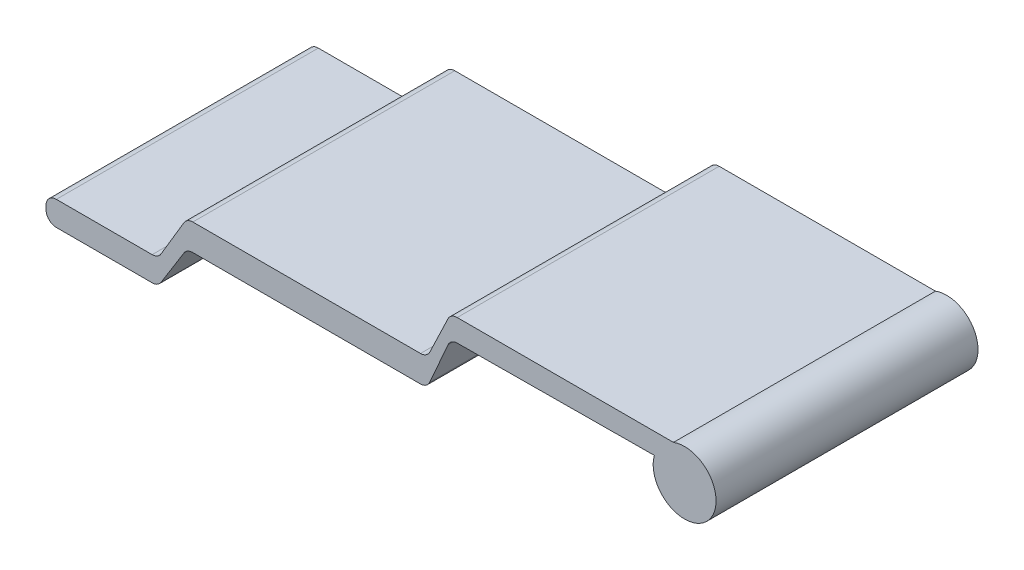
from build123d import *

# Parameters (mm, degrees)
SKETCH_3_R      = 4.562700836
EXTRUDE_3_DEPTH = 38


with BuildPart() as part:
    # 草图3 → 凸台-拉伸3 (new body)
    with BuildSketch(Plane.XY):
        with Locations((92.630544214, 13.494641075)):
            Circle(SKETCH_3_R)
        with BuildLine():
            ThreePointArc((91.130544214, 14.762196375), (92.191204386, 15.201536203), (92.630544214, 16.262196375))
            ThreePointArc((92.630544214, 16.262196375), (92.191204386, 17.322856547), (91.130544214, 17.762196375))
            Line((91.130544214, 17.762196375), (59.64523969, 17.762196375))
            ThreePointArc((59.64523969, 17.762196375), (58.845330036, 17.531111086), (58.291883519, 16.909055768))
            Line((58.291883519, 16.909055768), (55.677790218, 11.439862088))
            ThreePointArc((55.677790218, 11.439862088), (55.124343701, 10.817806769), (54.324434046, 10.586721481))
            Line((54.324434046, 10.586721481), (21.297445186, 10.586721481))
            ThreePointArc((21.297445186, 10.586721481), (20.556052671, 10.390691242), (20.008440624, 9.853837664))
            Line((20.008440624, 9.853837664), (16.684963935, 4.269316435))
            ThreePointArc((16.684963935, 4.269316435), (16.137351889, 3.732462858), (15.395959373, 3.536432619))
            Line((15.395959373, 3.536432619), (1.5, 3.536432619))
            ThreePointArc((1.5, 3.536432619), (0.439339828, 3.09709279), (0, 2.036432619))
            Line((0, 2.036432619), (0, 1.5))
            ThreePointArc((0, 1.5), (0.439339828, 0.439339828), (1.5, 0))
            Line((1.5, 0), (15.415084557, 0))
            ThreePointArc((15.415084557, 0), (16.143809475, 0.188908854), (16.688984275, 0.708053342))
            Line((16.688984275, 0.708053342), (20.004420285, 6.041156217))
            ThreePointArc((20.004420285, 6.041156217), (20.549595084, 6.560300705), (21.278320002, 6.749209559))
            Line((21.278320002, 6.749209559), (54.290974396, 6.749209559))
            ThreePointArc((54.290974396, 6.749209559), (55.110835464, 6.99309339), (55.664095388, 7.645439121))
            Line((55.664095388, 7.645439121), (58.305578349, 13.652814563))
            ThreePointArc((58.305578349, 13.652814563), (58.858838273, 14.305160293), (59.678699341, 14.549044125))
            Line((59.678699341, 14.549044125), (91.130544214, 14.762196375))
        make_face()
    extrude(amount=EXTRUDE_3_DEPTH)


solid = part.part
